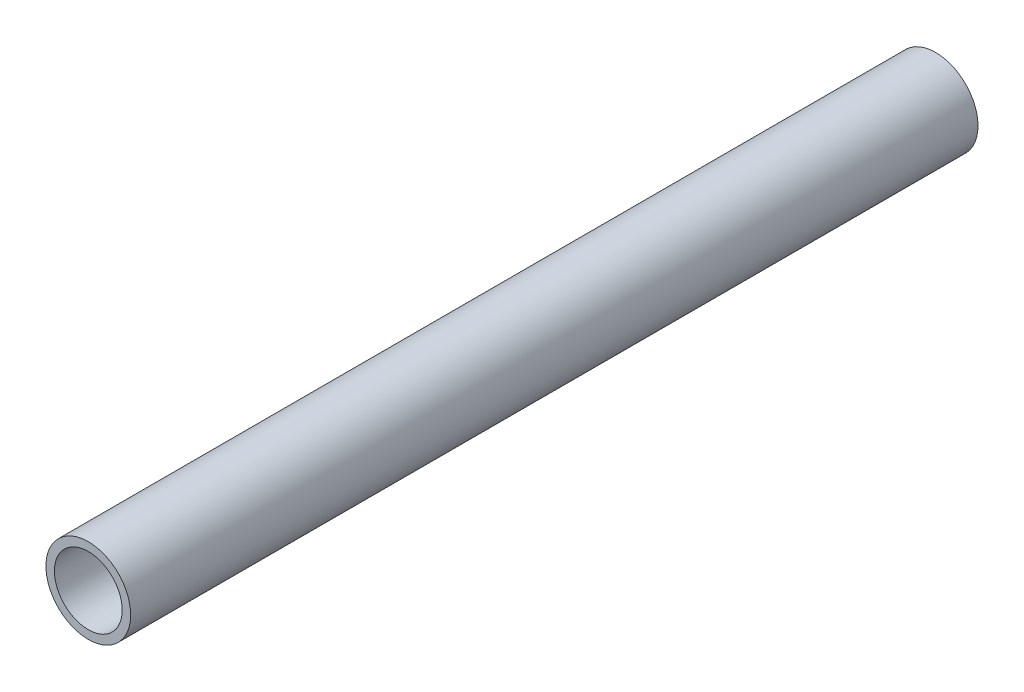
from build123d import *

# Parameters (mm, degrees)
SKETCH_1_R        = 5
SKETCH_1_R_2      = 4
EXTRUDE_274_DEPTH = 100


with BuildPart() as part:
    # Эскиз1 → Extrude 274 (new body)
    with BuildSketch(Plane.XY):
        Circle(SKETCH_1_R)
        Circle(SKETCH_1_R_2, mode=Mode.SUBTRACT)
    extrude(amount=EXTRUDE_274_DEPTH)


solid = part.part
